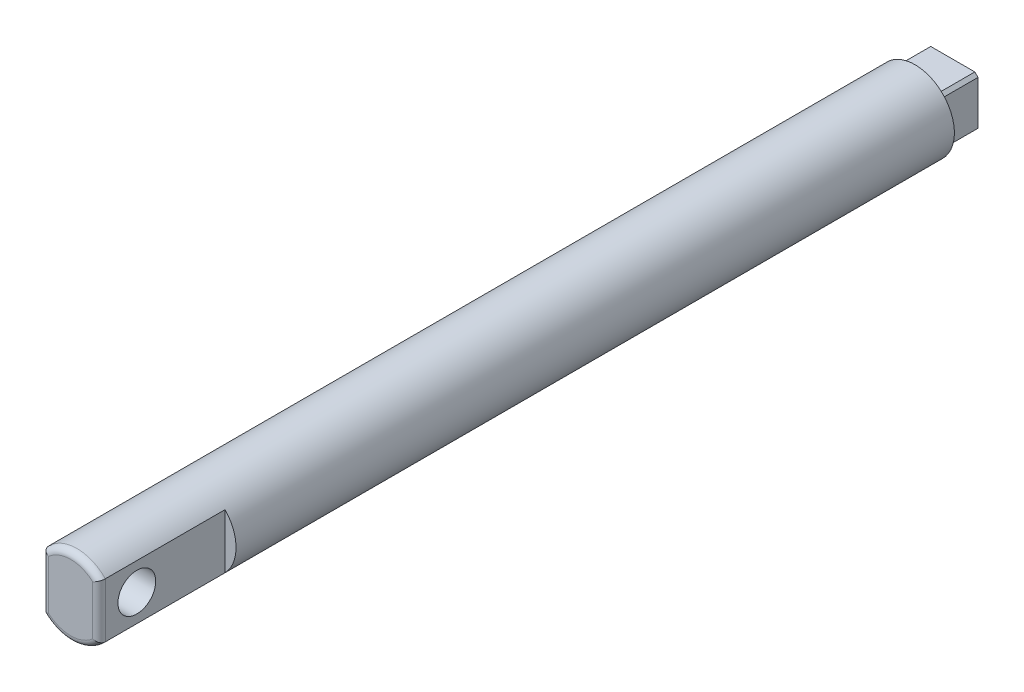
from build123d import *

# Parameters (mm, degrees)
SKETCH1_R             = 12.5
BOSS_EXTRUDE1_DEPTH   = 280
CUT_EXTRUDE1_START    = -40
CUT_EXTRUDE1_DEPTH    = 40
SKETCH3_R             = 6
CUT_EXTRUDE2_DEPTH    = 282.102294548
FILLET1_R             = 2
SKETCH4_R             = 12.5
SKETCH4_W             = 16
SKETCH4_H             = 16
CUT_EXTRUDE3_DEPTH    = 12
M6_TAPPED_HOLE1_D     = 5
M6_TAPPED_HOLE1_DEPTH = 15
M6_TAPPED_HOLE1_TIP   = 1.502151548
CHAMFER1_SIZE         = 1


with BuildPart() as part:
    # Sketch1 → Boss-Extrude1 (new body)
    with BuildSketch(Plane.XY):
        Circle(SKETCH1_R)
    extrude(amount=BOSS_EXTRUDE1_DEPTH)

    # Sketch2 → Cut-Extrude1 (cut)
    with BuildSketch(Plane.XY.offset(280).offset(CUT_EXTRUDE1_START)):
        with BuildLine():
            Line((-9, -8.674675786), (-9, 8.674675786))
            ThreePointArc((-9, 8.674675786), (-12.5, 0), (-9, -8.674675786))
        make_face()
        with BuildLine():
            ThreePointArc((9, -8.674675786), (12.5, 0), (9, 8.674675786))
            Line((9, 8.674675786), (9, -8.674675786))
        make_face()
    extrude(amount=CUT_EXTRUDE1_DEPTH, mode=Mode.SUBTRACT)

    # Sketch3 → Cut-Extrude2 (cut, through all)
    with BuildSketch(Plane.ZY.offset(9)):
        with Locations((268, 0)):
            Circle(SKETCH3_R)
    extrude(amount=-CUT_EXTRUDE2_DEPTH, mode=Mode.SUBTRACT)

    # Fillet1
    fillet1_edges = [part.edges().sort_by_distance(p)[0] for p in [
        (0, 12.5, 280),
        (9, 0, 280),
        (0, -12.5, 280),
        (-9, 0, 280),
    ]]
    fillet(fillet1_edges, radius=FILLET1_R)

    # Sketch4 → Cut-Extrude3 (cut)
    with BuildSketch(Plane(origin=(0, 0, 0), x_dir=(-1, 0, 0), z_dir=(0, 0, -1))):
        Circle(SKETCH4_R)
        Rectangle(SKETCH4_W, SKETCH4_H, mode=Mode.SUBTRACT)
    extrude(amount=-CUT_EXTRUDE3_DEPTH, mode=Mode.SUBTRACT)

    # M6 Tapped Hole1
    with Locations(Plane(origin=(0, 0, 0), x_dir=(-1, 0, 0), z_dir=(0, 0, -1))):
        with Locations((0, 0)):
            Hole(M6_TAPPED_HOLE1_D / 2, depth=M6_TAPPED_HOLE1_DEPTH)
            with Locations((0, 0, -(M6_TAPPED_HOLE1_DEPTH + M6_TAPPED_HOLE1_TIP / 2))):  # 118° drill point
                Cone(0, M6_TAPPED_HOLE1_D / 2, M6_TAPPED_HOLE1_TIP, mode=Mode.SUBTRACT)

    # Chamfer1
    chamfer1_edges = [part.edges().sort_by_distance(p)[0] for p in [
        (-8, -8, 6),
        (-8, 8, 6),
        (8, -8, 6),
        (8, 8, 6),
    ]]
    chamfer(chamfer1_edges, length=CHAMFER1_SIZE)


solid = part.part
